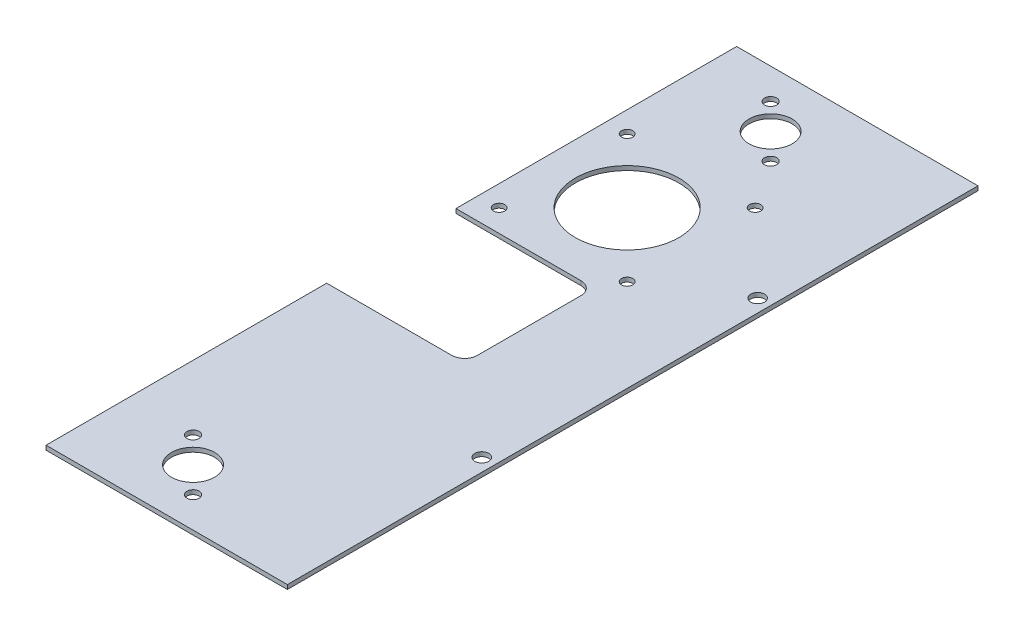
from build123d import *

# Parameters (mm, degrees)
SKETCH1_R                 = 19.05
SKETCH1_R_2               = 7.9375
SKETCH1_R_3               = 2.062114731
BOSS_EXTRUDE1_DEPTH       = 1.5875
F_10_CLEARANCE_HOLE1_D    = 5.1054
F_8_CLEARANCE_HOLE1_D     = 4.4958
F_8_CLEARANCE_HOLE1_DEPTH = 6.35
F_8_CLEARANCE_HOLE1_TIP   = 1.350674586


with BuildPart() as part:
    # Sketch1 → Boss-Extrude1 (new body)
    with BuildSketch(Plane(origin=(0, 0, 0), x_dir=(1, 0, 0), z_dir=(0, 1, 0))):
        with BuildLine():
            Line((-22.186740071, -110.035971993), (-22.186740071, -213.413971993))
            Line((-22.186740071, -213.413971993), (66.713259929, -213.413971993))
            Line((66.713259929, -213.413971993), (66.713259929, 40.967028007))
            Line((66.713259929, 40.967028007), (-22.186740071, 40.967028007))
            Line((-22.186740071, 40.967028007), (-22.186740071, -62.410971993))
            Line((-22.186740071, -62.410971993), (23.850759929, -62.410971993))
            ThreePointArc((23.850759929, -62.410971993), (27.218355974, -63.805875948), (28.613259929, -67.173471993))
            Line((28.613259929, -67.173471993), (28.613259929, -105.273471993))
            ThreePointArc((28.613259929, -105.273471993), (27.218355974, -108.641068039), (23.850759929, -110.035971993))
            Line((23.850759929, -110.035971993), (-22.186740071, -110.035971993))
        make_face()
        with Locations(Location((9.106059929, -30.660971993, 0), (0, 0, 270))):
            Circle(SKETCH1_R, mode=Mode.SUBTRACT)
        with Locations(Location((11.150759929, 20.139028007, 0), (0, 0, 270))):
            Circle(SKETCH1_R_2, mode=Mode.SUBTRACT)
        with Locations(Location((11.150759929, -192.585971993, 0), (0, 0, 270))):
            Circle(SKETCH1_R_2, mode=Mode.SUBTRACT)
        with Locations(Location((-14.465140071, -7.089771993, 0), (0, 0, 270))):
            Circle(SKETCH1_R_3, mode=Mode.SUBTRACT)
        with Locations(Location((32.677259929, -7.089771993, 0), (0, 0, 90))):
            Circle(SKETCH1_R_3, mode=Mode.SUBTRACT)
        with Locations(Location((32.677259929, -54.232171993, 0), (0, 0, 270))):
            Circle(SKETCH1_R_3, mode=Mode.SUBTRACT)
        with Locations(Location((-14.465140071, -54.232171993, 0), (0, 0, 90))):
            Circle(SKETCH1_R_3, mode=Mode.SUBTRACT)
    extrude(amount=BOSS_EXTRUDE1_DEPTH)

    # #10 Clearance Hole1 (through all)
    with Locations(Plane(origin=(0, 1.5875, 0), x_dir=(1, 0, 0), z_dir=(0, 1, 0))):
        with Locations((61.950759929, -137.023471993), (61.950759929, -35.423471993)):
            Hole(F_10_CLEARANCE_HOLE1_D / 2)

    # #8 Clearance Hole1
    with Locations(Plane(origin=(0, 1.5875, 0), x_dir=(1, 0, 0), z_dir=(0, 1, 0))):
        with Locations((1.625759929, 29.664028007), (20.675759929, 10.614028007), (1.625759929, -183.060971993), (20.675759929, -202.110971993)):
            Hole(F_8_CLEARANCE_HOLE1_D / 2, depth=F_8_CLEARANCE_HOLE1_DEPTH)
            with Locations((0, 0, -(F_8_CLEARANCE_HOLE1_DEPTH + F_8_CLEARANCE_HOLE1_TIP / 2))):  # 118° drill point
                Cone(0, F_8_CLEARANCE_HOLE1_D / 2, F_8_CLEARANCE_HOLE1_TIP, mode=Mode.SUBTRACT)


solid = part.part
